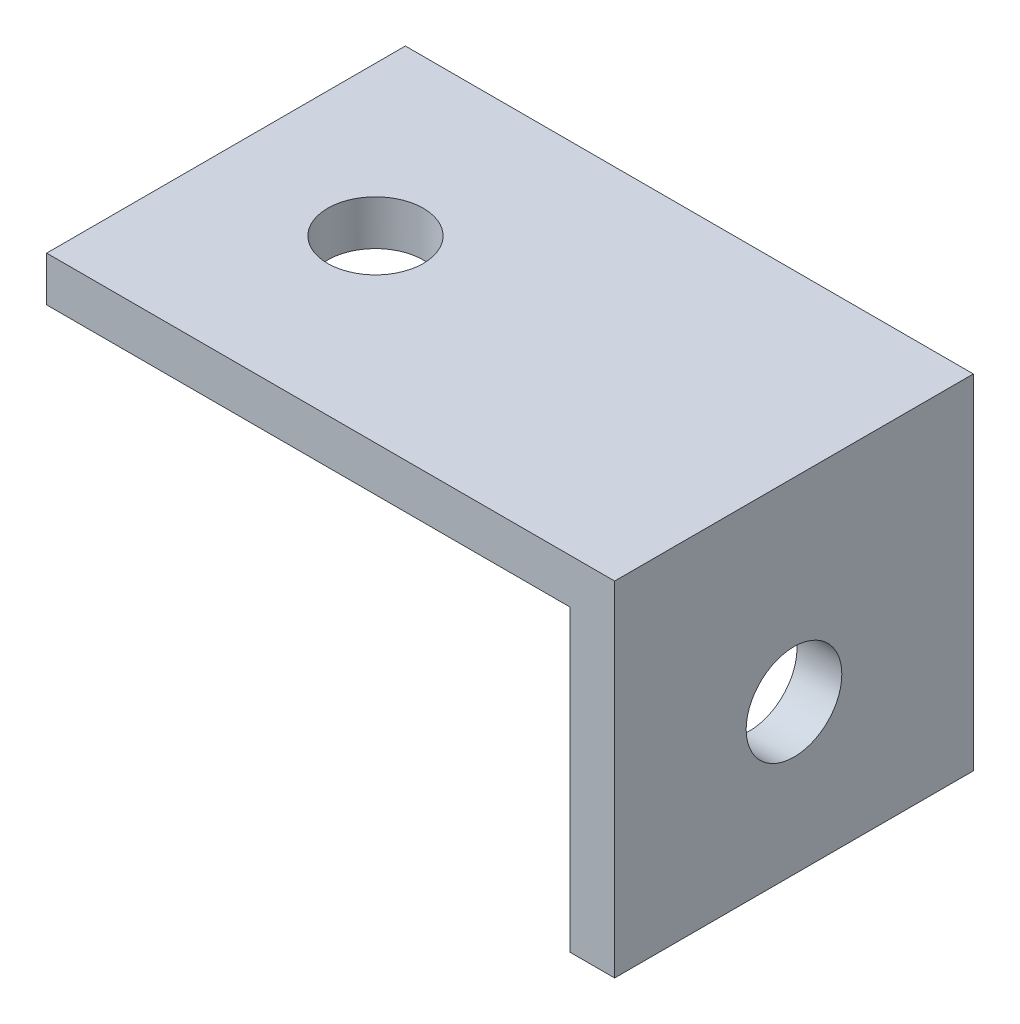
from build123d import *

# Parameters (mm, degrees)
F_1P5MM_12_DEPTH            = 12
CUT_EXTRUDE_M3_DEPTH        = 100
CUT_EXTRUDE_M3_DEPTH_BACK   = 100
SKETCH_2_R                  = 1.6
CUT_EXTRUDE_M3_2_DEPTH      = 100
CUT_EXTRUDE_M3_2_DEPTH_BACK = 100
SKETCH_3_R                  = 1.6


with BuildPart() as part:
    # 草图1 → 1p5mm直角固定座_宽12 (new body)
    with BuildSketch(Plane.XY):
        Polygon((-5, 0), (12.5, 0), (12.5, -10), (14, -10), (14, 1.5), (-5, 1.5), align=None)
    extrude(amount=F_1P5MM_12_DEPTH)

    # 草图2 → Cut-Extrude M3 (cut, two sides: drawn at the far end of the back side and taken through both)
    with BuildSketch(Plane(origin=(0, 0, 0), x_dir=(1, 0, 0), z_dir=(0, 1, 0)).offset(-CUT_EXTRUDE_M3_DEPTH_BACK)):
        with Locations(Location((0, -6, 0), (0, 0, 270))):
            Circle(SKETCH_2_R)
    extrude(amount=CUT_EXTRUDE_M3_DEPTH + CUT_EXTRUDE_M3_DEPTH_BACK, mode=Mode.SUBTRACT)

    # 草图3 → Cut-Extrude M3 2 (cut, two sides: drawn at the far end of the back side and taken through both)
    with BuildSketch(Plane(origin=(0, 0, 0), x_dir=(0, 0, -1), z_dir=(1, 0, 0)).offset(-CUT_EXTRUDE_M3_2_DEPTH_BACK)):
        with Locations((-6, -5)):
            Circle(SKETCH_3_R)
    extrude(amount=CUT_EXTRUDE_M3_2_DEPTH + CUT_EXTRUDE_M3_2_DEPTH_BACK, mode=Mode.SUBTRACT)


solid = part.part
